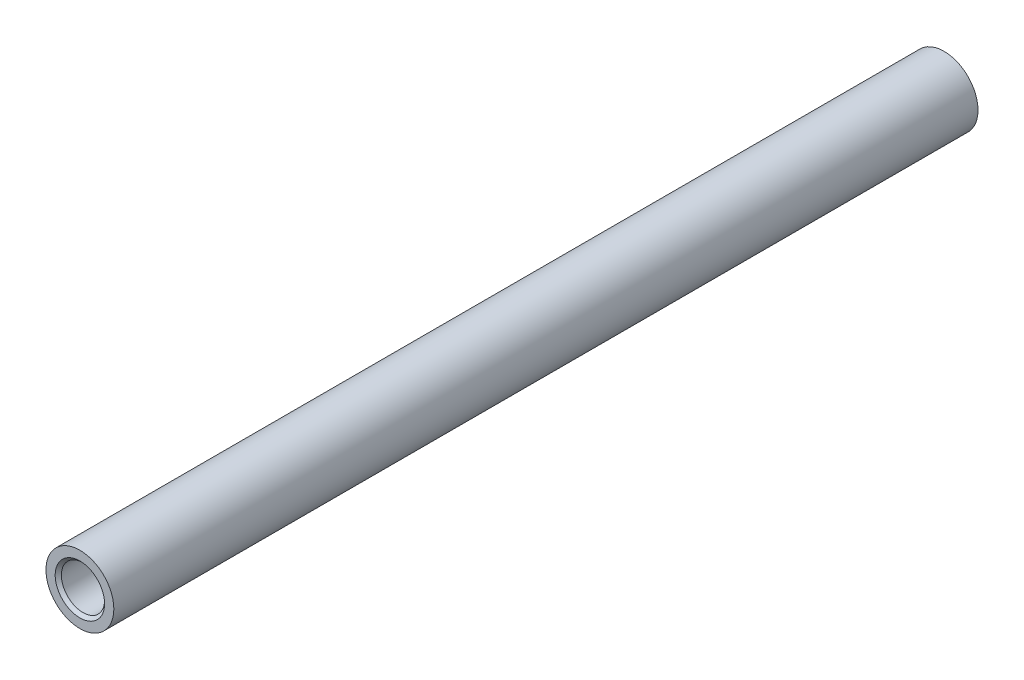
from build123d import *

# Parameters (mm, degrees)
SZKIC1_R                    = 11
SZKIC1_R_2                  = 7
DODANIE_WYCI_GNI_CIE1_DEPTH = 140
SZKIC2_R                    = 8
WYTNIJ_WYCI_GNI_CIE1_DEPTH  = 50
SFAZOWANIE1_SIZE            = 1


with BuildPart() as part:
    # Szkic1 → Dodanie-wyciągnięcie1 (new, symmetric)
    with BuildSketch(Plane.XY):
        Circle(SZKIC1_R)
        Circle(SZKIC1_R_2, mode=Mode.SUBTRACT)
    extrude(amount=DODANIE_WYCI_GNI_CIE1_DEPTH, both=True)

    # Szkic2 → Wytnij-wyciągnięcie1 (cut)
    with BuildSketch(Plane(origin=(0, 0, -140), x_dir=(-1, 0, 0), z_dir=(0, 0, -1))):
        Circle(SZKIC2_R)
    extrude(amount=-WYTNIJ_WYCI_GNI_CIE1_DEPTH, mode=Mode.SUBTRACT)

    # Sfazowanie1
    sfazowanie1_edges = [part.edges().sort_by_distance(p)[0] for p in [
        (-7, 0, 140),
    ]]
    chamfer(sfazowanie1_edges, length=SFAZOWANIE1_SIZE)


solid = part.part
